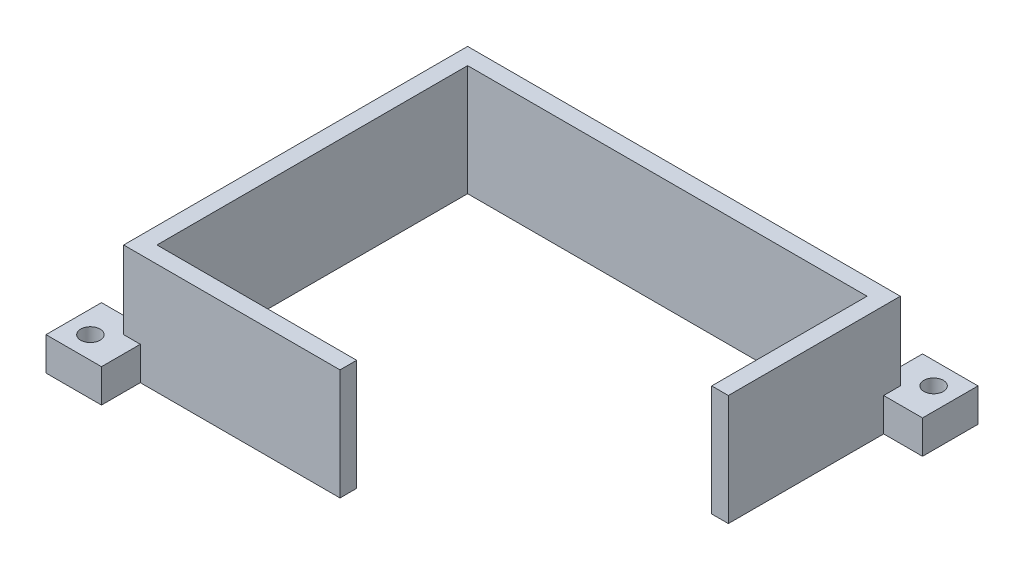
from build123d import *

# Parameters (mm, degrees)
EXTRUDE_1_DEPTH = 20
SKETCH_2_W      = 10
SKETCH_2_H      = 10
SKETCH_2_R      = 1.75
EXTRUDE_2_DEPTH = 6


with BuildPart() as part:
    # 草图1 → 凸台-拉伸1 (new body)
    with BuildSketch(Plane(origin=(0, 0, 0), x_dir=(1, 0, 0), z_dir=(0, 1, 0))):
        Polygon((0, -28), (0, -31), (-39, -31), (-39, 31), (39, 31), (39, 0), (36, 0), (36, 28), (-36, 28), (-36, -28), align=None)
    extrude(amount=EXTRUDE_1_DEPTH)

    # 草图2 → 凸台-拉伸2 (add)
    # profile 1 of 3: a face of its own
    with BuildSketch(Plane.XZ):
        with Locations((-41, 33)):
            Rectangle(SKETCH_2_W, SKETCH_2_H)
        with Locations(Location((-42, 34, 0), (0, 0, 270))):
            Circle(SKETCH_2_R, mode=Mode.SUBTRACT)
    # profile 2 of 3: a face of its own
    with BuildSketch(Plane.XZ):
        with Locations((-41, -33)):
            Rectangle(SKETCH_2_W, SKETCH_2_H)
        with Locations(Location((-42, -34, 0), (0, 0, 90))):
            Circle(SKETCH_2_R, mode=Mode.SUBTRACT)
    # profile 3 of 3: a face of its own
    with BuildSketch(Plane.XZ):
        with Locations((41, -33)):
            Rectangle(SKETCH_2_W, SKETCH_2_H)
        with Locations(Location((42, -34, 0), (0, 0, 270))):
            Circle(SKETCH_2_R, mode=Mode.SUBTRACT)
    extrude(amount=-EXTRUDE_2_DEPTH)


solid = part.part
